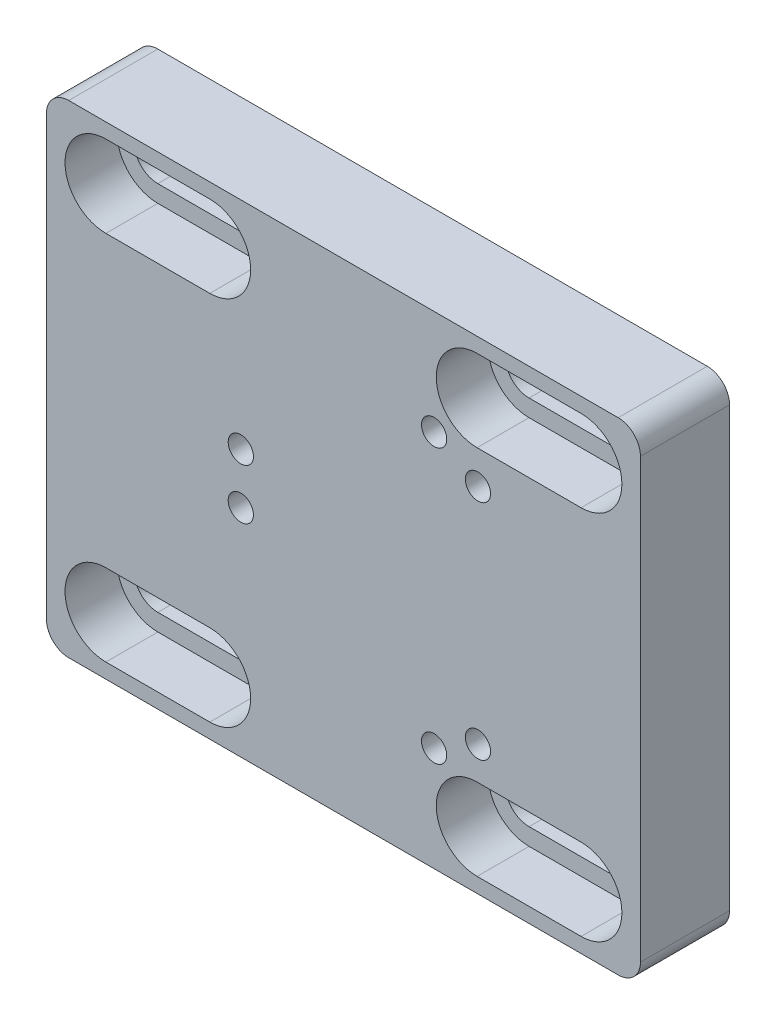
from build123d import *

# Parameters (mm, degrees)
SKETCH_1_W          = 80
SKETCH_1_H          = 65
SKETCH_1_R          = 1.7
SKETCH_1_R_2        = 3.2
EXTRUDE_1_DEPTH     = 12
SKETCH_2_R          = 3
CUT_EXTRUDE_1_DEPTH = 9.4
FILLET_1_R          = 3
CUT_EXTRUDE_2_DEPTH = 7
CUT_EXTRUDE_3_DEPTH = 53.012017842


with BuildPart() as part:
    # 스케치1 → 보스-돌출1 (new body)
    with BuildSketch(Plane.XY):
        Rectangle(SKETCH_1_W, SKETCH_1_H)
        with Locations((-13.82389773, -3.407324542)):
            Circle(SKETCH_1_R, mode=Mode.SUBTRACT)
        with Locations((-13.82389773, 3.407324542)):
            Circle(SKETCH_1_R, mode=Mode.SUBTRACT)
        with Locations((18.112778477, 15.031324063)):
            Circle(SKETCH_1_R, mode=Mode.SUBTRACT)
        with Locations((12.211119252, 18.438648605)):
            Circle(SKETCH_1_R, mode=Mode.SUBTRACT)
        with Locations((12.211119252, -18.438648605)):
            Circle(SKETCH_1_R, mode=Mode.SUBTRACT)
        with Locations((18.112778477, -15.031324063)):
            Circle(SKETCH_1_R, mode=Mode.SUBTRACT)
        with Locations((25, -25)):
            Circle(SKETCH_1_R_2, mode=Mode.SUBTRACT)
        with Locations((25, 25)):
            Circle(SKETCH_1_R_2, mode=Mode.SUBTRACT)
        with Locations((-25, 25)):
            Circle(SKETCH_1_R_2, mode=Mode.SUBTRACT)
        with Locations((-25, -25)):
            Circle(SKETCH_1_R_2, mode=Mode.SUBTRACT)
    extrude(amount=EXTRUDE_1_DEPTH)

    # 스케치2 → 컷-돌출1 (cut)
    with BuildSketch(Plane(origin=(0, 0, 0), x_dir=(-1, 0, 0), z_dir=(0, 0, -1))):
        with Locations((-12.211119252, 18.438648605)):
            Circle(SKETCH_2_R)
        with Locations((-18.112778477, 15.031324063)):
            Circle(SKETCH_2_R)
        with Locations((-12.211119252, -18.438648605)):
            Circle(SKETCH_2_R)
        with Locations((-18.112778477, -15.031324063)):
            Circle(SKETCH_2_R)
        with Locations((13.82389773, -3.407324542)):
            Circle(SKETCH_2_R)
        with Locations((13.82389773, 3.407324542)):
            Circle(SKETCH_2_R)
    extrude(amount=-CUT_EXTRUDE_1_DEPTH, mode=Mode.SUBTRACT)

    # 필렛1
    fillet_1_edges = [part.edges().sort_by_distance(p)[0] for p in [
        (40, 32.5, 6),
        (40, -32.5, 6),
        (-40, -32.5, 6),
        (-40, 32.5, 6),
    ]]
    fillet(fillet_1_edges, radius=FILLET_1_R)

    # 스케치3 → 컷-돌출2 (cut)
    with BuildSketch(Plane.XY.offset(12)):
        with BuildLine():
            Line((-32, 30.5), (-18, 30.5))
            ThreePointArc((-18, 30.5), (-12.5, 25), (-18, 19.5))
            Line((-18, 19.5), (-32, 19.5))
            ThreePointArc((-32, 19.5), (-37.5, 25), (-32, 30.5))
        make_face()
        with BuildLine():
            Line((32, 19.5), (18, 19.5))
            ThreePointArc((18, 19.5), (12.5, 25), (18, 30.5))
            Line((18, 30.5), (32, 30.5))
            ThreePointArc((32, 30.5), (37.5, 25), (32, 19.5))
        make_face()
        with BuildLine():
            Line((32, -30.5), (18, -30.5))
            ThreePointArc((18, -30.5), (12.5, -25), (18, -19.5))
            Line((18, -19.5), (32, -19.5))
            ThreePointArc((32, -19.5), (37.5, -25), (32, -30.5))
        make_face()
        with BuildLine():
            Line((-32, -19.5), (-18, -19.5))
            ThreePointArc((-18, -19.5), (-12.5, -25), (-18, -30.5))
            Line((-18, -30.5), (-32, -30.5))
            ThreePointArc((-32, -30.5), (-37.5, -25), (-32, -19.5))
        make_face()
    extrude(amount=-CUT_EXTRUDE_2_DEPTH, mode=Mode.SUBTRACT)

    # 스케치4 → 컷-돌출3 (cut, through all)
    with BuildSketch(Plane.XY.offset(5)):
        with BuildLine():
            Line((-32, 28.2), (-18, 28.2))
            ThreePointArc((-18, 28.2), (-14.8, 25), (-18, 21.8))
            Line((-18, 21.8), (-32, 21.8))
            ThreePointArc((-32, 21.8), (-35.2, 25), (-32, 28.2))
        make_face()
        with BuildLine():
            Line((18, 28.2), (32, 28.2))
            ThreePointArc((32, 28.2), (35.2, 25), (32, 21.8))
            Line((32, 21.8), (18, 21.8))
            ThreePointArc((18, 21.8), (14.8, 25), (18, 28.2))
        make_face()
        with BuildLine():
            Line((32, -28.2), (18, -28.2))
            ThreePointArc((18, -28.2), (14.8, -25), (18, -21.8))
            Line((18, -21.8), (32, -21.8))
            ThreePointArc((32, -21.8), (35.2, -25), (32, -28.2))
        make_face()
        with BuildLine():
            Line((-32, -21.8), (-18, -21.8))
            ThreePointArc((-18, -21.8), (-14.8, -25), (-18, -28.2))
            Line((-18, -28.2), (-32, -28.2))
            ThreePointArc((-32, -28.2), (-35.2, -25), (-32, -21.8))
        make_face()
    extrude(amount=-CUT_EXTRUDE_3_DEPTH, mode=Mode.SUBTRACT)


solid = part.part
